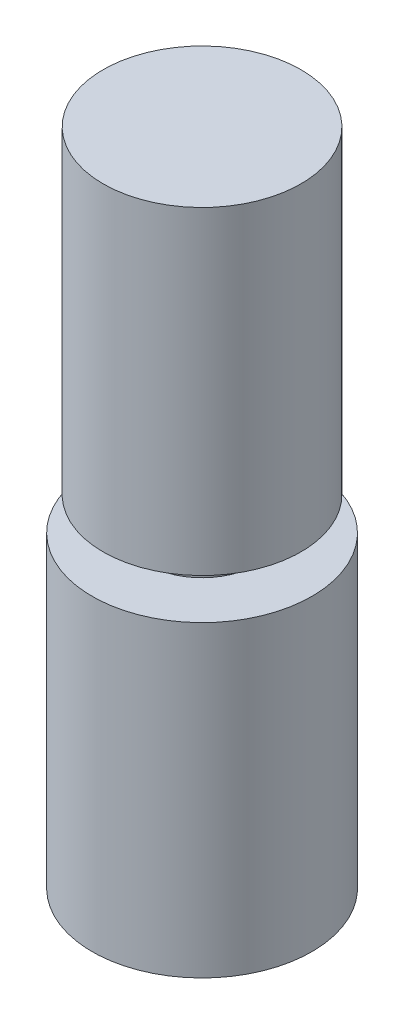
from build123d import *


with BuildPart() as part:
    # 草图1 → 旋转2 (revolve)
    with BuildSketch(Plane.XY, mode=Mode.PRIVATE) as revolve_2_sk:
        Polygon((0, 0), (0, 120), (-18, 120), (-18, 62), (-10, 62), (-10, 56), (-20, 56), (-20, 0), align=None)
    revolve(revolve_2_sk.sketch.rotate(Axis((0, 0, 0), (0, 1, 0)), 270), axis=Axis((0, 0, 0), (0, 1, 0)))


solid = part.part
